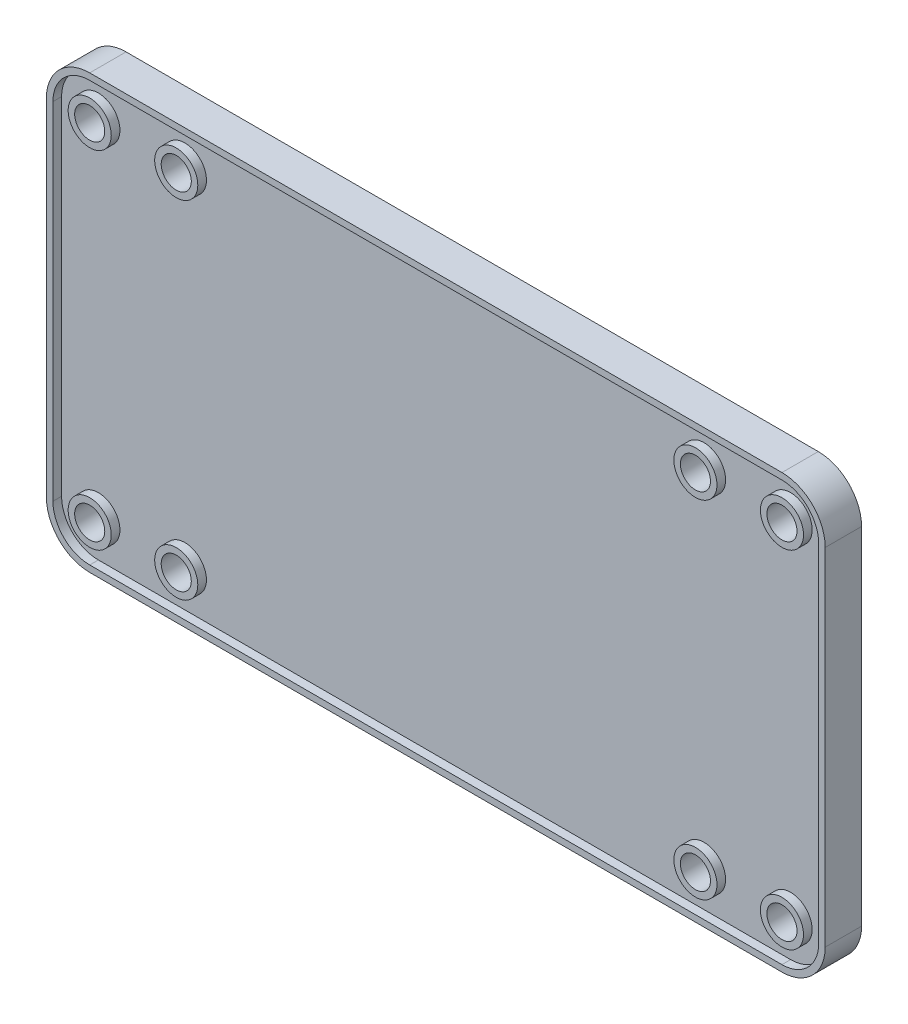
from build123d import *

# Parameters (mm, degrees)
SKETCH1_R           = 2.2098
BOSS_EXTRUDE1_DEPTH = 3.175
SKETCH2_R           = 3.1623
CUT_EXTRUDE3_DEPTH  = 1.27
SKETCH3_R           = 2.2098
SKETCH3_R_2         = 5.08
BOSS_EXTRUDE2_DEPTH = 2.159


with BuildPart() as part:
    # Sketch1 → Boss-Extrude1 (new body)
    with BuildSketch(Plane.XY):
        with BuildLine():
            Line((-50.8, -31.75), (50.8, -31.75))
            ThreePointArc((50.8, -31.75), (55.290128061, -29.890128061), (57.15, -25.4))
            Line((57.15, -25.4), (57.15, 25.4))
            ThreePointArc((57.15, 25.4), (55.290128061, 29.890128061), (50.8, 31.75))
            Line((50.8, 31.75), (-50.8, 31.75))
            ThreePointArc((-50.8, 31.75), (-55.290128061, 29.890128061), (-57.15, 25.4))
            Line((-57.15, 25.4), (-57.15, -25.4))
            ThreePointArc((-57.15, -25.4), (-55.290128061, -29.890128061), (-50.8, -31.75))
        make_face()
        with Locations((-50.8, -25.4)):
            Circle(SKETCH1_R, mode=Mode.SUBTRACT)
        with Locations((-38.1, -25.4)):
            Circle(SKETCH1_R, mode=Mode.SUBTRACT)
        with Locations(Location((-50.8, 25.4, 0), (0, 0, 180))):
            Circle(SKETCH1_R, mode=Mode.SUBTRACT)
        with Locations(Location((-38.1, 25.4, 0), (0, 0, 180))):
            Circle(SKETCH1_R, mode=Mode.SUBTRACT)
        with Locations((50.8, 25.4)):
            Circle(SKETCH1_R, mode=Mode.SUBTRACT)
        with Locations((38.1, 25.4)):
            Circle(SKETCH1_R, mode=Mode.SUBTRACT)
        with Locations(Location((50.8, -25.4, 0), (0, 0, 180))):
            Circle(SKETCH1_R, mode=Mode.SUBTRACT)
        with Locations(Location((38.1, -25.4, 0), (0, 0, 180))):
            Circle(SKETCH1_R, mode=Mode.SUBTRACT)
    extrude(amount=-BOSS_EXTRUDE1_DEPTH)

    # Sketch2 → Cut-Extrude3 (cut)
    with BuildSketch(Plane.XY):
        with BuildLine():
            Line((50.8, 30.7975), (-50.8, 30.7975))
            ThreePointArc((-50.8, 30.7975), (-54.616608851, 29.216608851), (-56.1975, 25.4))
            Line((-56.1975, 25.4), (-56.1975, -25.4))
            ThreePointArc((-56.1975, -25.4), (-54.616608851, -29.216608851), (-50.8, -30.7975))
            Line((-50.8, -30.7975), (50.8, -30.7975))
            ThreePointArc((50.8, -30.7975), (54.616608851, -29.216608851), (56.1975, -25.4))
            Line((56.1975, -25.4), (56.1975, 25.4))
            ThreePointArc((56.1975, 25.4), (54.616608851, 29.216608851), (50.8, 30.7975))
        make_face()
        with Locations((38.1, 25.4)):
            Circle(SKETCH2_R, mode=Mode.SUBTRACT)
        with Locations((50.8, 25.4)):
            Circle(SKETCH2_R, mode=Mode.SUBTRACT)
        with Locations((50.8, -25.4)):
            Circle(SKETCH2_R, mode=Mode.SUBTRACT)
        with Locations((38.1, -25.4)):
            Circle(SKETCH2_R, mode=Mode.SUBTRACT)
        with Locations((-38.1, -25.4)):
            Circle(SKETCH2_R, mode=Mode.SUBTRACT)
        with Locations((-50.8, -25.4)):
            Circle(SKETCH2_R, mode=Mode.SUBTRACT)
        with Locations((-38.1, 25.4)):
            Circle(SKETCH2_R, mode=Mode.SUBTRACT)
        with Locations((-50.8, 25.4)):
            Circle(SKETCH2_R, mode=Mode.SUBTRACT)
    extrude(amount=-CUT_EXTRUDE3_DEPTH, mode=Mode.SUBTRACT)

    # Sketch3 → Boss-Extrude2 (add)
    with BuildSketch(Plane(origin=(0, 0, -3.175), x_dir=(-1, 0, 0), z_dir=(0, 0, -1))):
        with BuildLine():
            Line((-57.15, 25.4), (-57.15, -25.4))
            ThreePointArc((-57.15, -25.4), (-55.290128061, -29.890128061), (-50.8, -31.75))
            Line((-50.8, -31.75), (50.8, -31.75))
            ThreePointArc((50.8, -31.75), (55.290128061, -29.890128061), (57.15, -25.4))
            Line((57.15, -25.4), (57.15, 25.4))
            ThreePointArc((57.15, 25.4), (55.290128061, 29.890128061), (50.8, 31.75))
            Line((50.8, 31.75), (-50.8, 31.75))
            ThreePointArc((-50.8, 31.75), (-55.290128061, 29.890128061), (-57.15, 25.4))
        make_face()
        with Locations((-50.8, -25.4)):
            Circle(SKETCH3_R, mode=Mode.SUBTRACT)
        with Locations((-38.1, -25.4)):
            Circle(SKETCH3_R, mode=Mode.SUBTRACT)
        with Locations(Location((38.1, -25.4, 0), (0, 0, 180))):
            Circle(SKETCH3_R, mode=Mode.SUBTRACT)
        with Locations(Location((50.8, -25.4, 0), (0, 0, 180))):
            Circle(SKETCH3_R, mode=Mode.SUBTRACT)
        with Locations((50.8, 25.4)):
            Circle(SKETCH3_R, mode=Mode.SUBTRACT)
        with Locations((38.1, 25.4)):
            Circle(SKETCH3_R, mode=Mode.SUBTRACT)
        with Locations(Location((-38.1, 25.4, 0), (0, 0, 180))):
            Circle(SKETCH3_R, mode=Mode.SUBTRACT)
        with Locations(Location((-50.8, 25.4, 0), (0, 0, 180))):
            Circle(SKETCH3_R, mode=Mode.SUBTRACT)
        Circle(SKETCH3_R_2, mode=Mode.SUBTRACT)
        with Locations((38.1, 0)):
            Circle(SKETCH3_R_2, mode=Mode.SUBTRACT)
        with Locations((-38.1, 0)):
            Circle(SKETCH3_R_2, mode=Mode.SUBTRACT)
    extrude(amount=BOSS_EXTRUDE2_DEPTH)


solid = part.part
